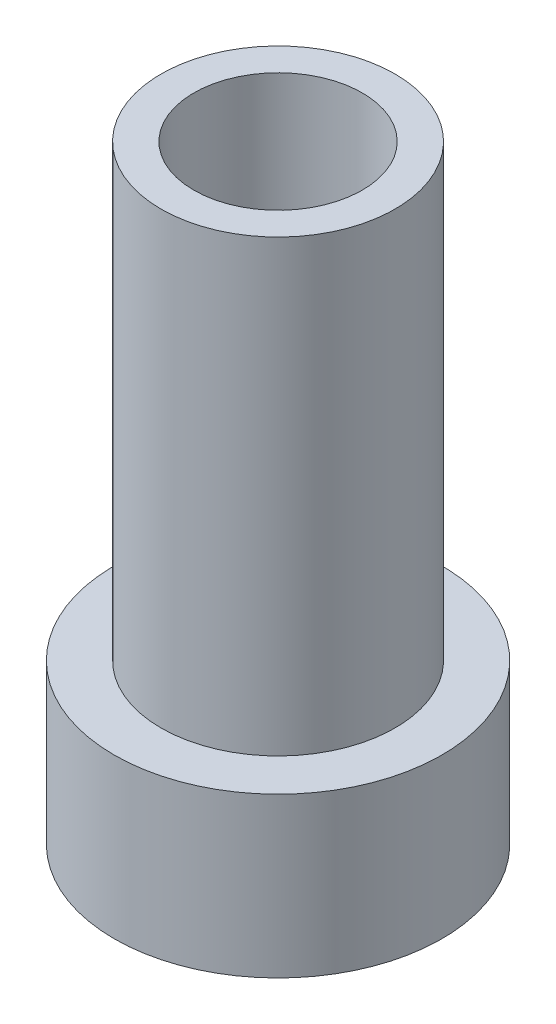
from build123d import *

# Parameters (mm, degrees)
BOSS_EXTRUDE4_DEPTH      = 2.0001
BOSS_EXTRUDE4_DEPTH_BACK = 15
SKETCH4_R                = 17.5
SKETCH4_R_2              = 12.5
SKETCH13_R               = 15
CUT_EXTRUDE8_DEPTH       = 2
SKETCH18_R               = 12.5
BOSS_EXTRUDE10_DEPTH     = 48
SKETCH21_R               = 9
CUT_EXTRUDE10_DEPTH      = 48


with BuildPart() as part:
    # Sketch4 → Boss-Extrude4 (new, two sides: drawn at the far end of the back side and taken through both)
    with BuildSketch(Plane(origin=(0, 0, 0), x_dir=(1, 0, 0), z_dir=(0, 1, 0)).offset(-BOSS_EXTRUDE4_DEPTH_BACK)):
        with Locations(Location((0, 0, 0), (0, 0, 270))):
            Circle(SKETCH4_R)
        with Locations(Location((0, 0, 0), (0, 0, 270))):
            Circle(SKETCH4_R_2, mode=Mode.SUBTRACT)
    extrude(amount=BOSS_EXTRUDE4_DEPTH + BOSS_EXTRUDE4_DEPTH_BACK)

    # Sketch13 → Cut-Extrude8 (cut)
    with BuildSketch(Plane(origin=(0, 0, 0), x_dir=(1, 0, 0), z_dir=(0, 1, 0))):
        with Locations(Location((0, 0, 0), (0, 0, 270))):
            Circle(SKETCH13_R)
    extrude(amount=CUT_EXTRUDE8_DEPTH, mode=Mode.SUBTRACT)


with BuildPart() as body_2:
    # Sketch18 → Boss-Extrude10 (new body)
    with BuildSketch(Plane(origin=(0, 2.0001, 0), x_dir=(1, 0, 0), z_dir=(0, 1, 0))):
        with Locations(Location((0, 0, 0), (0, 0, 270))):
            Circle(SKETCH18_R)
    extrude(amount=BOSS_EXTRUDE10_DEPTH)

    # Sketch21 → Cut-Extrude10 (cut)
    with BuildSketch(Plane(origin=(0, 2.0001, 0), x_dir=(1, 0, 0), z_dir=(0, 1, 0))):
        with Locations(Location((0, 0, 0), (0, 0, 270))):
            Circle(SKETCH21_R)
    extrude(amount=CUT_EXTRUDE10_DEPTH, mode=Mode.SUBTRACT)


solid = Compound([part.part, body_2.part])
